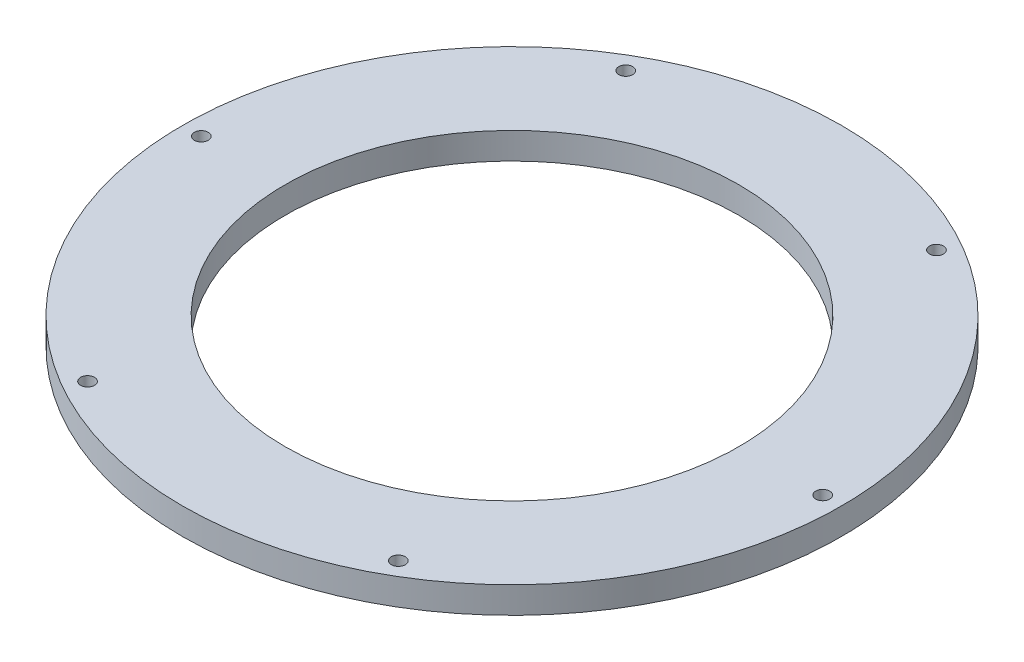
from build123d import *

# Parameters (mm, degrees)
SKETCH1_R           = 236
SKETCH1_R_2         = 162.5
BOSS_EXTRUDE1_DEPTH = 9.5
SKETCH2_R           = 5
CUT_EXTRUDE1_DEPTH  = 335.294780097


with BuildPart() as part:
    # Sketch1 → Boss-Extrude1 (new, symmetric)
    with BuildSketch(Plane(origin=(0, 0, 0), x_dir=(1, 0, 0), z_dir=(0, 1, 0))):
        with Locations(Location((0, 0, 0), (0, 0, 270))):
            Circle(SKETCH1_R)
        with Locations(Location((0, 0, 0), (0, 0, 270))):
            Circle(SKETCH1_R_2, mode=Mode.SUBTRACT)
    extrude(amount=BOSS_EXTRUDE1_DEPTH, both=True)

    # Sketch2 → Cut-Extrude1 (cut, through all)
    with BuildSketch(Plane(origin=(0, 9.5, 0), x_dir=(1, 0, 0), z_dir=(0, 1, 0))):
        with Locations(Location((-111.25, 192.690652342, 0), (0, 0, 270))):
            Circle(SKETCH2_R)
        with Locations(Location((222.5, 0, 0), (0, 0, 270))):
            Circle(SKETCH2_R)
        with Locations(Location((111.25, 192.690652342, 0), (0, 0, 90))):
            Circle(SKETCH2_R)
        with Locations(Location((-222.5, 0, 0), (0, 0, 90))):
            Circle(SKETCH2_R)
        with Locations(Location((111.25, -192.690652342, 0), (0, 0, 270))):
            Circle(SKETCH2_R)
        with Locations(Location((-111.25, -192.690652342, 0), (0, 0, 90))):
            Circle(SKETCH2_R)
    extrude(amount=-CUT_EXTRUDE1_DEPTH, mode=Mode.SUBTRACT)


solid = part.part
